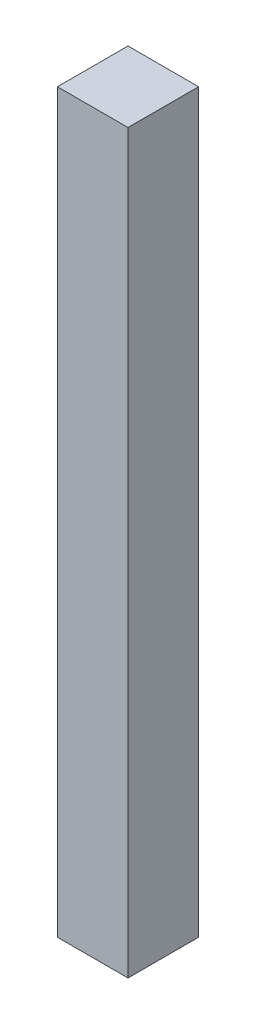
from build123d import *

# Parameters (mm, degrees)
SKETCH1_W           = 9.271
SKETCH1_H           = 9.271
BOSS_EXTRUDE1_DEPTH = 96.731666667


with BuildPart() as part:
    # Sketch1 → Boss-Extrude1 (new body)
    with BuildSketch(Plane(origin=(0, -45.00889512, 0), x_dir=(1, 0, 0), z_dir=(0, 1, 0))):
        with Locations((-71.94339959, -45.717920544)):
            Rectangle(SKETCH1_W, SKETCH1_H)
    extrude(amount=BOSS_EXTRUDE1_DEPTH)


solid = part.part
